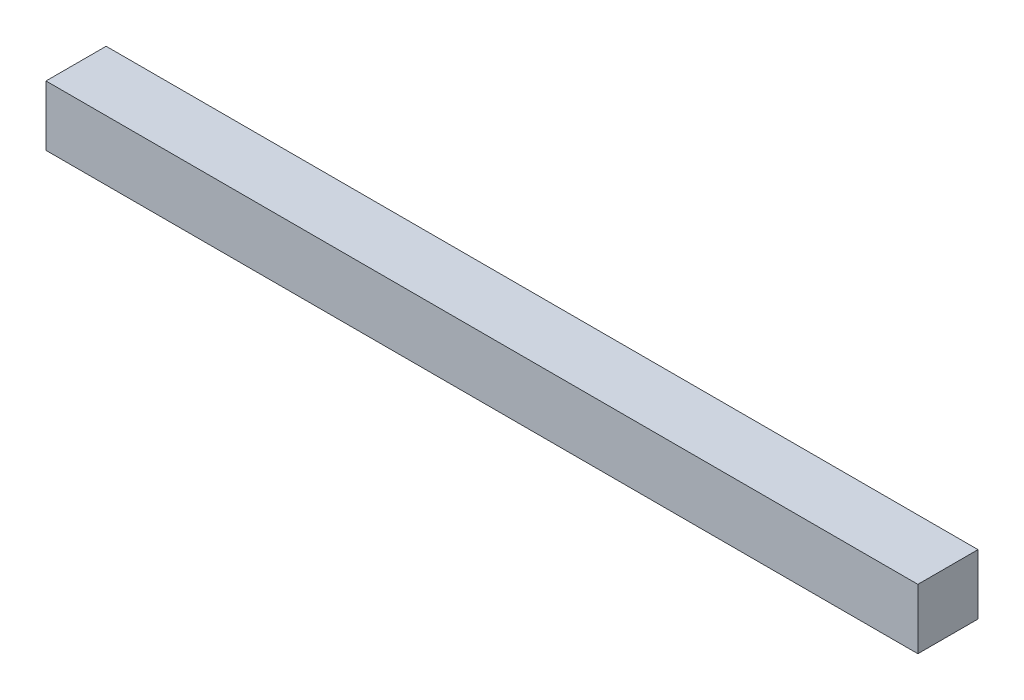
from build123d import *

# Parameters (mm, degrees)
LRAF_CAPRAZ_CUBUK_8X8_1_START = -52
SKETCH1_W                     = 116
SKETCH1_H                     = 8
LRAF_CAPRAZ_CUBUK_8X8_1_DEPTH = 8


with BuildPart() as part:
    # Sketch1 → LRAF_capraz_cubuk_8x8_1 (new body)
    with BuildSketch(Plane.XY.offset(LRAF_CAPRAZ_CUBUK_8X8_1_START)):
        with Locations((0, 26)):
            Rectangle(SKETCH1_W, SKETCH1_H)
    extrude(amount=-LRAF_CAPRAZ_CUBUK_8X8_1_DEPTH)


solid = part.part
